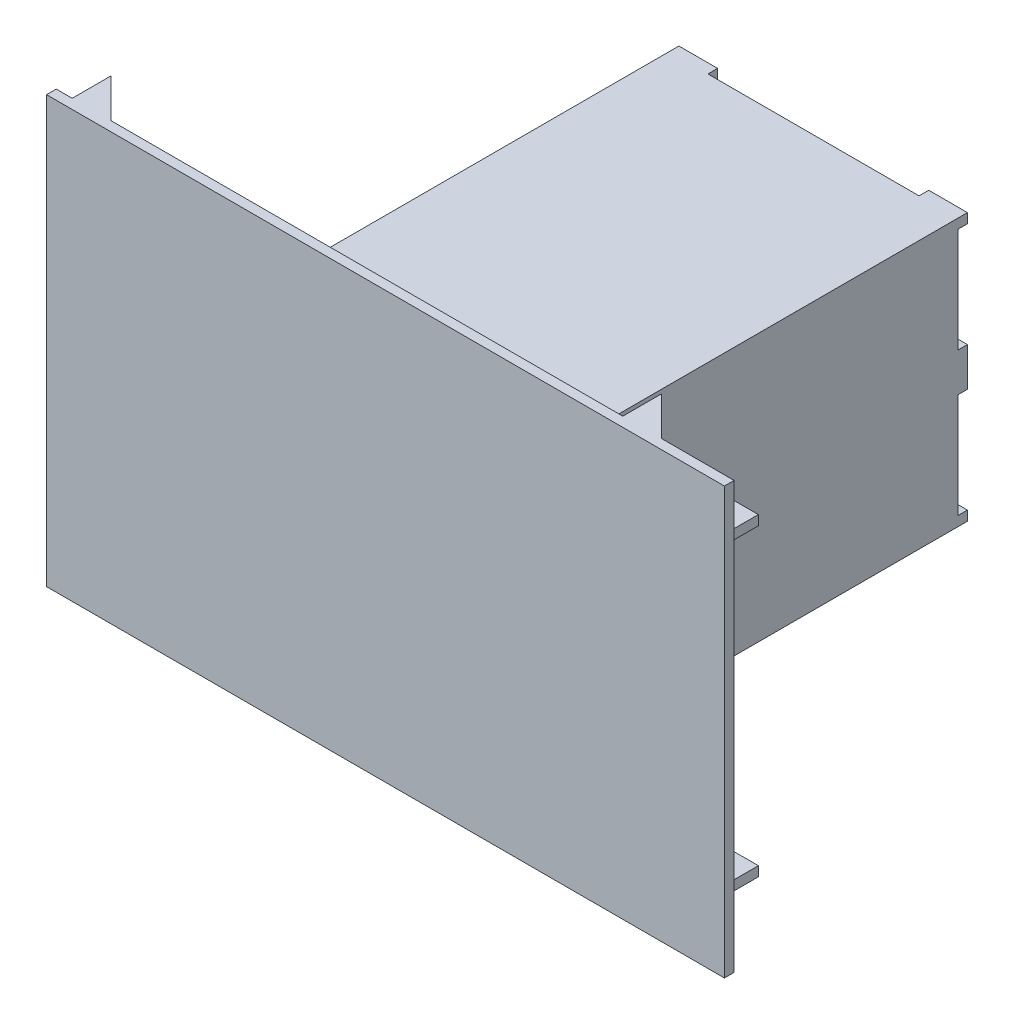
from build123d import *

# Parameters (mm, degrees)
SKETCH_1_W      = 149
SKETCH_1_H      = 138
SKETCH_1_W_2    = 62.5
SKETCH_1_H_2    = 122
EXTRUDE_1_DEPTH = 216
SKETCH_2_W      = 5
SKETCH_2_H      = 20
SKETCH_2_W_2    = 20
SKETCH_2_H_2    = 5
EXTRUDE_2_DEPTH = 5
SKETCH_3_W      = 350
SKETCH_3_H      = 220
EXTRUDE_3_DEPTH = 5
EXTRUDE_START   = 12
EXTRUDE_4_DEPTH = 29
SKETCH_6_W      = 50
SKETCH_6_H      = 20
EXTRUDE_5_DEPTH = 5


with BuildPart() as part:
    # 草图1 → 凸台-拉伸1 (new body)
    with BuildSketch(Plane.XY):
        Rectangle(SKETCH_1_W, SKETCH_1_H)
        with Locations((35.25, 0)):
            Rectangle(SKETCH_1_W_2, SKETCH_1_H_2, mode=Mode.SUBTRACT)
        with Locations((-35.25, 0)):
            Rectangle(SKETCH_1_W_2, SKETCH_1_H_2, mode=Mode.SUBTRACT)
    extrude(amount=EXTRUDE_1_DEPTH)

    # 草图2 → 凸台-拉伸2 (add)
    with BuildSketch(Plane(origin=(0, 0, 0), x_dir=(-1, 0, 0), z_dir=(0, 0, -1))):
        with Locations((72, 0)):
            Rectangle(SKETCH_2_W, SKETCH_2_H)
        with Locations((-72, 0)):
            Rectangle(SKETCH_2_W, SKETCH_2_H)
        with Locations((64.5, 66.5)):
            Rectangle(SKETCH_2_W_2, SKETCH_2_H_2)
        with Locations((-64.5, 66.5)):
            Rectangle(SKETCH_2_W_2, SKETCH_2_H_2)
        with Locations((64.5, -66.5)):
            Rectangle(SKETCH_2_W_2, SKETCH_2_H_2)
        with Locations((-64.5, -66.5)):
            Rectangle(SKETCH_2_W_2, SKETCH_2_H_2)
    extrude(amount=EXTRUDE_2_DEPTH)

    # 草图3 → 凸台-拉伸3 (add)
    with BuildSketch(Plane.XY.offset(216)):
        Rectangle(SKETCH_3_W, SKETCH_3_H)
    extrude(amount=EXTRUDE_3_DEPTH)

    # 草图5 → 凸台-拉伸4 (add)
    with BuildSketch(Plane(origin=(0, 69, 0), x_dir=(1, 0, 0), z_dir=(0, 1, 0)).offset(EXTRUDE_START)):
        Polygon((-146.754147686, -216), (-166.754147686, -196), (-166.754147686, -216), align=None)
        Polygon((117.545852314, -216), (137.545852314, -216), (117.545852314, -196), align=None)
    extrude_4 = extrude(amount=EXTRUDE_4_DEPTH)

    # 草图6 → 凸台-拉伸5 (add)
    with BuildSketch(Plane.XZ.offset(-81)):
        with Locations((142.545852314, 206)):
            Rectangle(SKETCH_6_W, SKETCH_6_H)
        with Locations((-141.754147686, 206)):
            Rectangle(SKETCH_6_W, SKETCH_6_H)
    extrude_5 = extrude(amount=EXTRUDE_5_DEPTH)

    # 镜向1: 凸台-拉伸4, 凸台-拉伸5 across plane
    add(extrude_4.mirror(Plane.ZX))
    add(extrude_5.mirror(Plane.ZX))


solid = part.part
